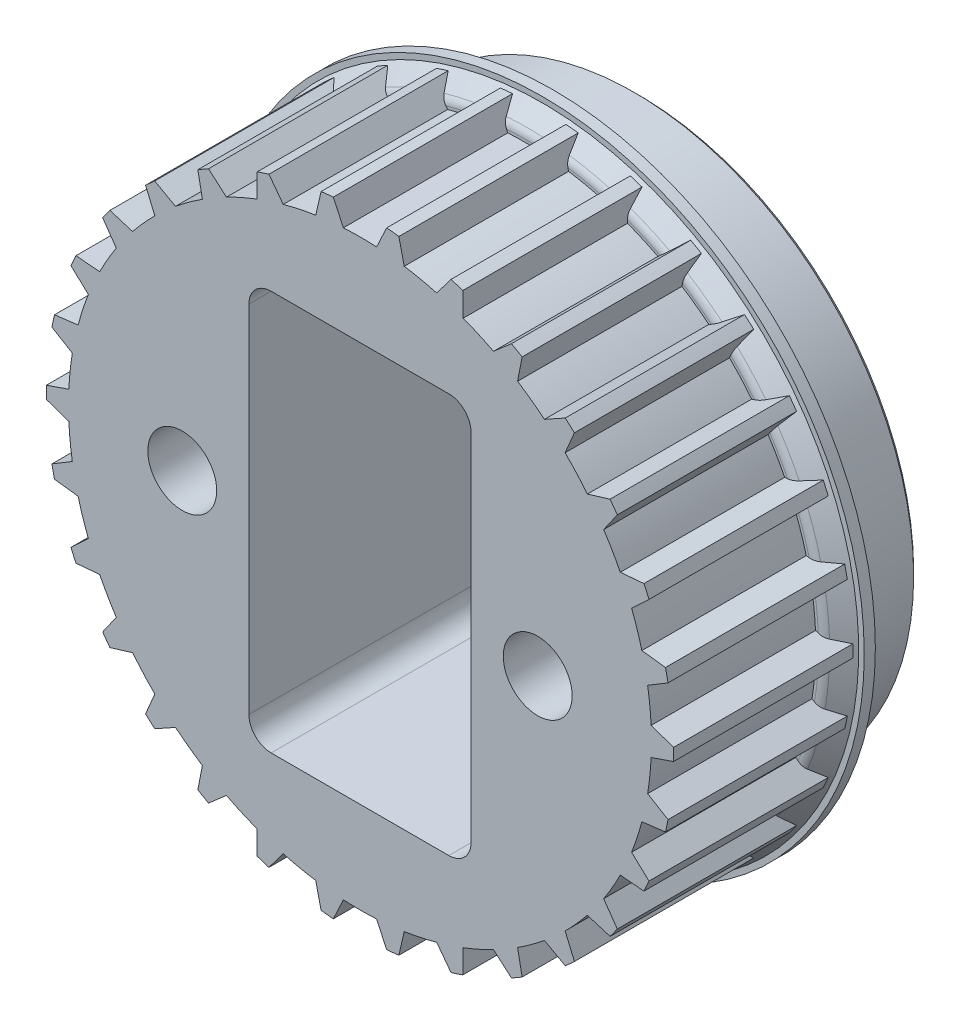
from build123d import *

# Parameters (mm, degrees)
SCHNITT_LINEAR_AUSTRAGEN1_DEPTH      = 22.586773728
KREISMUSTER1_COUNT                   = 30
SCHNITT_LINEAR_AUSTRAGEN2_DEPTH      = 23.084836427
SCHNITT_LINEAR_AUSTRAGEN2_DEPTH_BACK = 23.084836427
SKIZZE4_R                            = 1.55
VERRUNDUNG1_R                        = 1.2
FASE1_SIZE                           = 0.2


with BuildPart() as part:
    # Skizze1 → Rotation1 (revolve)
    with BuildSketch(Plane(origin=(0, 0, 0), x_dir=(0, 0, -1), z_dir=(1, 0, 0))):
        Polygon((-4.35, 14.12), (4.35, 14.12), (4.35, 12.575), (8.2, 12.575), (8.2, 0), (-4.35, 0), (-4.35, 12.575), align=None)
    revolve(axis=Axis((0, 0, 46.515199561), (0, 0, -1)))

    # Skizze2 → Schnitt-Linear austragen1 (cut, symmetric)
    with BuildSketch(Plane.XY):
        with BuildLine():
            Line((-1.2, 14.068916092), (-0.747573546, 13.09868443))
            ThreePointArc((-0.747573546, 13.09868443), (0, 13.12), (0.747573546, 13.09868443))
            Line((0.747573546, 13.09868443), (1.2, 14.068916092))
            ThreePointArc((1.2, 14.068916092), (0, 14.12), (-1.2, 14.068916092))
        make_face()
    schnitt_linear_austragen1 = extrude(amount=SCHNITT_LINEAR_AUSTRAGEN1_DEPTH, both=True, mode=Mode.SUBTRACT)

    # Kreismuster1: Schnitt-Linear austragen1 ×30 about axis
    kreismuster1_axis = Axis((0, 0, 9.02), (0, 0, -1))
    for i in range(1, KREISMUSTER1_COUNT):
        add(schnitt_linear_austragen1.rotate(kreismuster1_axis, i * 360 / KREISMUSTER1_COUNT), mode=Mode.SUBTRACT)

    # Skizze3 → Rotation2 (revolve)
    with BuildSketch(Plane(origin=(0, 0, 0), x_dir=(0, 0, -1), z_dir=(1, 0, 0))):
        with BuildLine():
            Line((4.35, 13), (4.35, 14.5))
            Line((4.35, 14.5), (3.85, 14.5))
            Line((3.85, 14.5), (3.85, 14.25))
            Line((3.85, 14.25), (3.196446609, 13.596446609))
            ThreePointArc((3.196446609, 13.596446609), (3.088060234, 13.434234935), (3.05, 13.242893219))
            Line((3.05, 13.242893219), (3.05, 13))
            Line((3.05, 13), (4.35, 13))
        make_face()
    revolve(axis=Axis((0, 0, -11.03129214), (0, 0, 1)))

    # Skizze4 → Schnitt-Linear austragen2 (cut, two sides: drawn at the far end of the back side and taken through both)
    with BuildSketch(Plane.XY.offset(-SCHNITT_LINEAR_AUSTRAGEN2_DEPTH_BACK)):
        with Locations((-8, 0)):
            Circle(SKIZZE4_R)
        with Locations((8, 0)):
            Circle(SKIZZE4_R)
        with BuildLine():
            Line((4, 9), (-4, 9))
            ThreePointArc((-4, 9), (-4.707106781, 8.707106781), (-5, 8))
            Line((-5, 8), (-5, -8))
            ThreePointArc((-5, -8), (-4.707106781, -8.707106781), (-4, -9))
            Line((-4, -9), (4, -9))
            ThreePointArc((4, -9), (4.707106781, -8.707106781), (5, -8))
            Line((5, -8), (5, 8))
            ThreePointArc((5, 8), (4.707106781, 8.707106781), (4, 9))
        make_face()
    extrude(amount=SCHNITT_LINEAR_AUSTRAGEN2_DEPTH + SCHNITT_LINEAR_AUSTRAGEN2_DEPTH_BACK, mode=Mode.SUBTRACT)

    # Verrundung1
    verrundung1_edges = [part.edges().sort_by_distance(p)[0] for p in [
        (-4.707106781, 8.707106781, -8.2),
        (0, 9, -8.2),
        (4.707106781, 8.707106781, -8.2),
        (5, 0, -8.2),
        (4.707106781, -8.707106781, -8.2),
        (0, -9, -8.2),
        (-4.707106781, -8.707106781, -8.2),
        (-5, 0, -8.2),
    ]]
    fillet(verrundung1_edges, radius=VERRUNDUNG1_R)

    # Fase1
    fase1_edges = [part.edges().sort_by_distance(p)[0] for p in [
        (-9.55, 0, -8.2),
        (6.45, 0, -8.2),
        (0, -12.575, -8.2),
    ]]
    chamfer(fase1_edges, length=FASE1_SIZE)


solid = part.part
